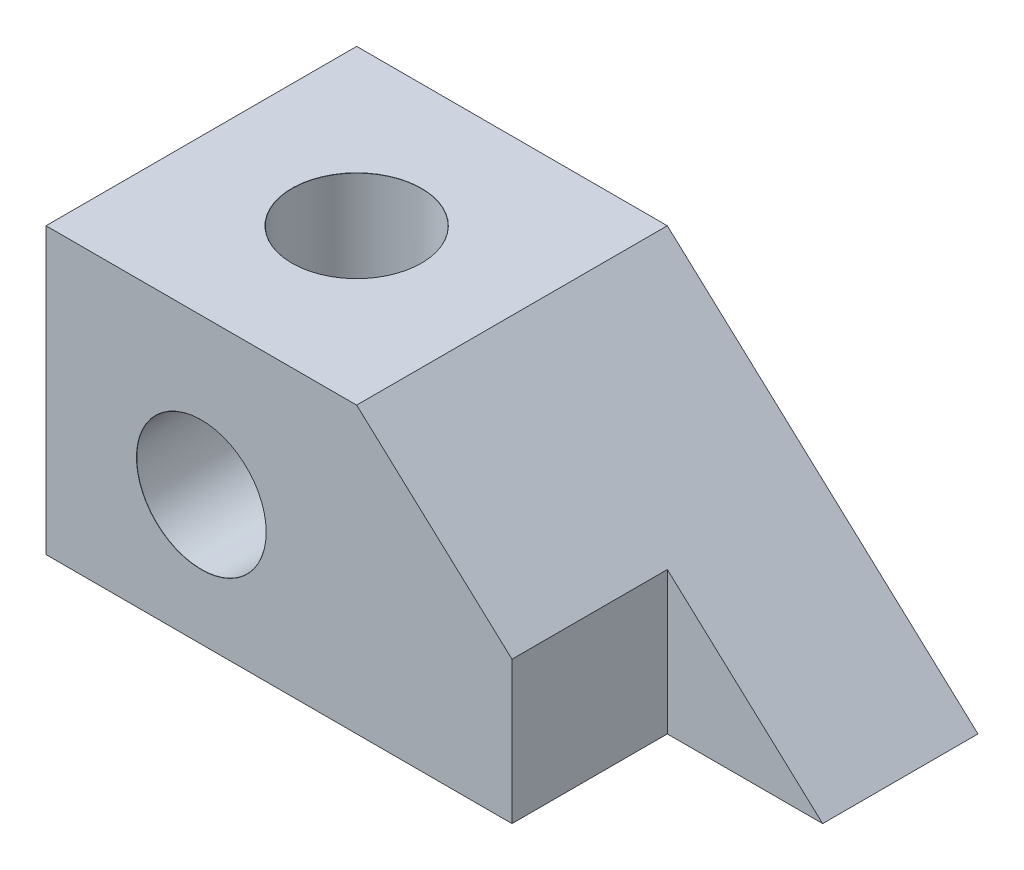
from build123d import *

# Parameters (mm, degrees)
BOSS_EXTRUDE1_DEPTH                  = 55
CUT_EXTRUDE2_DEPTH                   = 146
F_25_0_25_DIAMETER_HOLE3_D           = 25
F_25_0_25_DIAMETER_HOLE3_CSINK_D     = 25.05
F_25_0_25_DIAMETER_HOLE3_CSINK_ANGLE = 90
F_25_0_25_DIAMETER_HOLE4_D           = 25
F_25_0_25_DIAMETER_HOLE4_CSINK_D     = 25.05
F_25_0_25_DIAMETER_HOLE4_CSINK_ANGLE = 90


with BuildPart() as part:
    # Sketch1 → Boss-Extrude1 (new body)
    with BuildSketch(Plane(origin=(0, 0, 0), x_dir=(1, 0, 0), z_dir=(0, 1, 0))):
        Polygon((0, 0), (90, 0), (90, 30), (120, 30), (120, 60), (102.487310381, 60), (0, 60), align=None)
    extrude(amount=BOSS_EXTRUDE1_DEPTH)

    # Sketch4 → Cut-Extrude2 (cut, through all)
    with BuildSketch(Plane.XY):
        Polygon((60, 55), (120, 0), (120, 55), align=None)
    extrude(amount=-CUT_EXTRUDE2_DEPTH, mode=Mode.SUBTRACT)

    # Ø25.0 (25) Diameter Hole3 (through all)
    with Locations(Plane(origin=(30, 25, 0), x_dir=(1, 0, 0), z_dir=(0, 0, 1))):
        with Locations((0, 0)):
            CounterSinkHole(F_25_0_25_DIAMETER_HOLE3_D / 2, F_25_0_25_DIAMETER_HOLE3_CSINK_D / 2, counter_sink_angle=F_25_0_25_DIAMETER_HOLE3_CSINK_ANGLE)

    # Ø25.0 (25) Diameter Hole4 (through all)
    with Locations(Plane(origin=(30, 55, -30), x_dir=(0, 0, 1), z_dir=(0, 1, 0))):
        with Locations((0, 0)):
            CounterSinkHole(F_25_0_25_DIAMETER_HOLE4_D / 2, F_25_0_25_DIAMETER_HOLE4_CSINK_D / 2, counter_sink_angle=F_25_0_25_DIAMETER_HOLE4_CSINK_ANGLE)


solid = part.part
